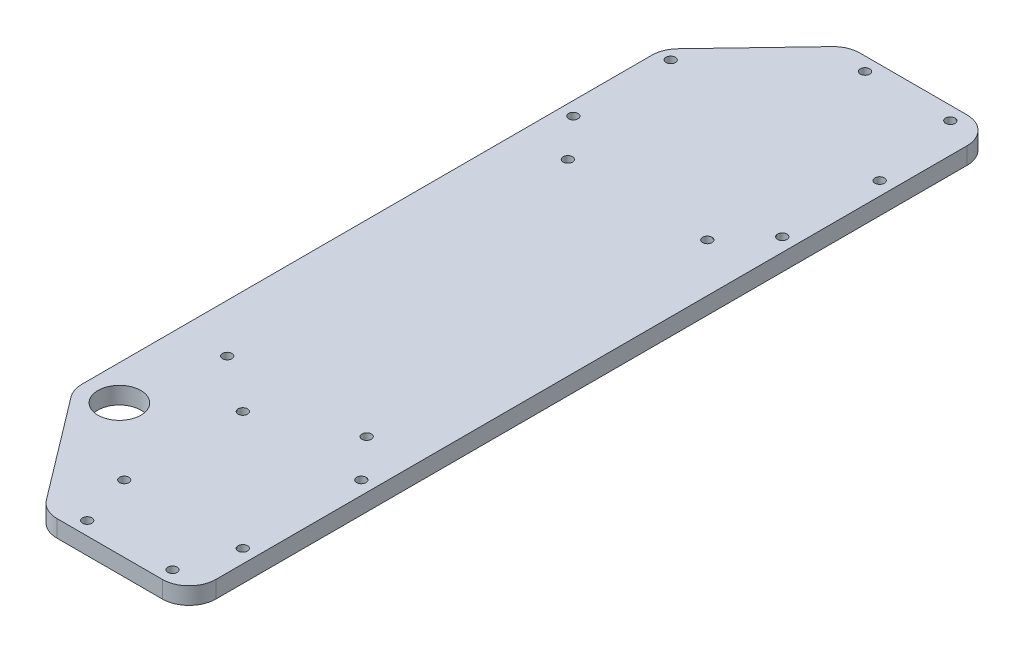
from build123d import *

# Parameters (mm, degrees)
SKETCH1_R           = 8
SKETCH1_R_2         = 1.75
BOSS_EXTRUDE1_DEPTH = 6.35
FILLET1_R           = 10


with BuildPart() as part:
    # Sketch1 → Boss-Extrude1 (new body)
    with BuildSketch(Plane(origin=(0, 0, 0), x_dir=(1, 0, 0), z_dir=(0, 1, 0))):
        Polygon((0, 44.633081493), (33.8, 0), (88, 0), (88, 300), (33.8, 300), (0, 264.520429961), align=None)
        with Locations(Location((13, 49, 0), (0, 0, 270))):
            Circle(SKETCH1_R, mode=Mode.SUBTRACT)
        with Locations(Location((38.8, 25, 0), (0, 0, 270))):
            Circle(SKETCH1_R_2, mode=Mode.SUBTRACT)
        with Locations(Location((38.8, 69.2, 0), (0, 0, 270))):
            Circle(SKETCH1_R_2, mode=Mode.SUBTRACT)
        with Locations(Location((18, 84.2, 0), (0, 0, 270))):
            Circle(SKETCH1_R_2, mode=Mode.SUBTRACT)
        with Locations(Location((45, 5, 0), (0, 0, 270))):
            Circle(SKETCH1_R_2, mode=Mode.SUBTRACT)
        with Locations(Location((76.8, 5, 0), (0, 0, 270))):
            Circle(SKETCH1_R_2, mode=Mode.SUBTRACT)
        with Locations(Location((83, 25, 0), (0, 0, 270))):
            Circle(SKETCH1_R_2, mode=Mode.SUBTRACT)
        with Locations(Location((83, 69.2, 0), (0, 0, 270))):
            Circle(SKETCH1_R_2, mode=Mode.SUBTRACT)
        with Locations(Location((70, 84.2, 0), (0, 0, 270))):
            Circle(SKETCH1_R_2, mode=Mode.SUBTRACT)
        with Locations(Location((18, 211.2, 0), (0, 0, 270))):
            Circle(SKETCH1_R_2, mode=Mode.SUBTRACT)
        with Locations(Location((5.05, 226.2, 0), (0, 0, 270))):
            Circle(SKETCH1_R_2, mode=Mode.SUBTRACT)
        with Locations(Location((5.05, 262.5, 0), (0, 0, 270))):
            Circle(SKETCH1_R_2, mode=Mode.SUBTRACT)
        with Locations(Location((70, 211.2, 0), (0, 0, 270))):
            Circle(SKETCH1_R_2, mode=Mode.SUBTRACT)
        with Locations(Location((45, 295, 0), (0, 0, 270))):
            Circle(SKETCH1_R_2, mode=Mode.SUBTRACT)
        with Locations(Location((82.95, 226.2, 0), (0, 0, 270))):
            Circle(SKETCH1_R_2, mode=Mode.SUBTRACT)
        with Locations(Location((76.8, 295, 0), (0, 0, 270))):
            Circle(SKETCH1_R_2, mode=Mode.SUBTRACT)
        with Locations(Location((82.95, 262.5, 0), (0, 0, 270))):
            Circle(SKETCH1_R_2, mode=Mode.SUBTRACT)
    extrude(amount=BOSS_EXTRUDE1_DEPTH)

    # Fillet1
    fillet1_edges = [part.edges().sort_by_distance(p)[0] for p in [
        (88, 3.175, -300),
        (88, 3.175, 0),
        (33.8, 3.175, 0),
        (0, 3.175, -44.633081493),
        (0, 3.175, -264.520429961),
        (33.8, 3.175, -300),
    ]]
    fillet(fillet1_edges, radius=FILLET1_R)


solid = part.part
